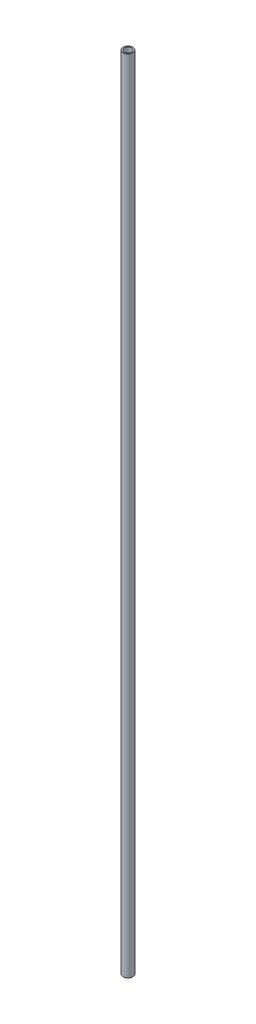
from build123d import *

# Parameters (mm, degrees)
SZKIC1_R                    = 4
SZKIC1_R_2                  = 3
DODANIE_WYCI_GNI_CIE1_DEPTH = 650


with BuildPart() as part:
    # Szkic1 → Dodanie-wyciągnięcie1 (new body)
    with BuildSketch(Plane(origin=(0, 0, 0), x_dir=(1, 0, 0), z_dir=(0, 1, 0))):
        with Locations(Location((0, 0, 0), (0, 0, 270))):
            Circle(SZKIC1_R)
        with Locations(Location((0, 0, 0), (0, 0, 270))):
            Circle(SZKIC1_R_2, mode=Mode.SUBTRACT)
    extrude(amount=DODANIE_WYCI_GNI_CIE1_DEPTH)


solid = part.part
